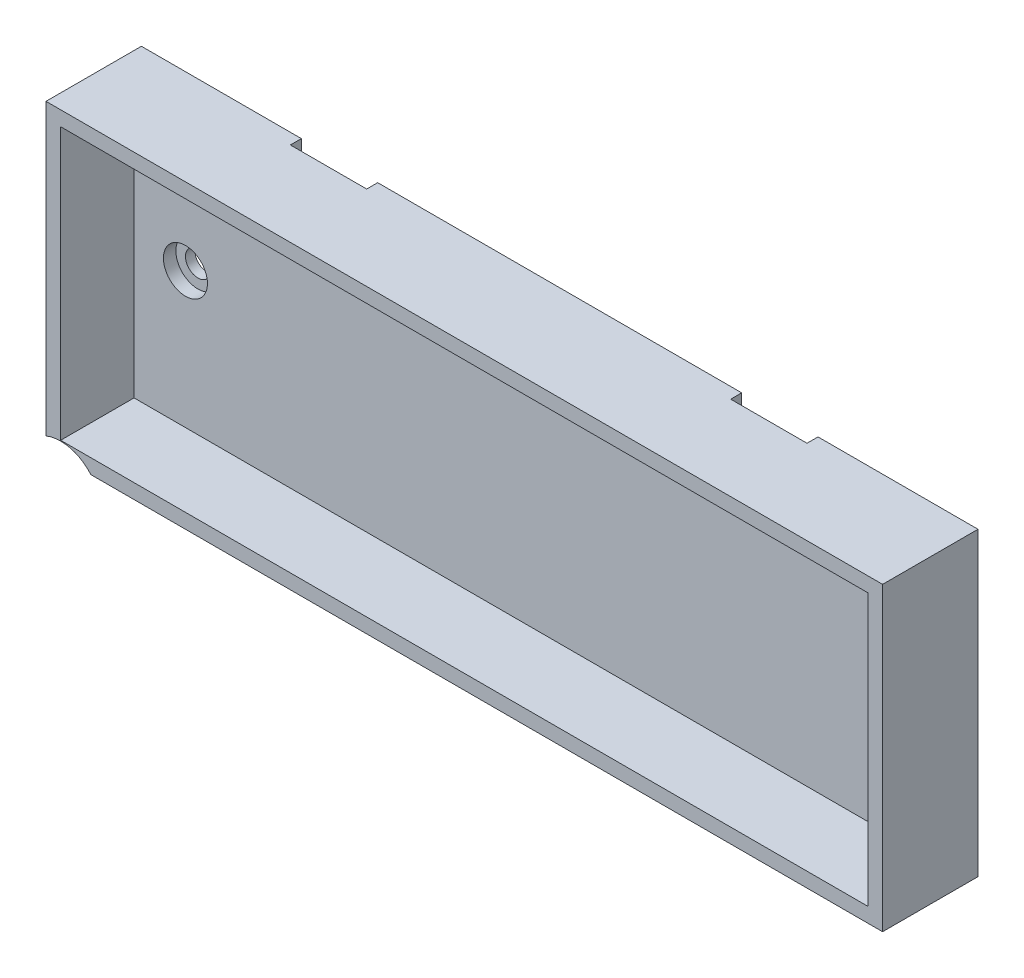
from build123d import *

# Parameters (mm, degrees)
MAIN_PROFILE_SKETCH_W       = 110
MAIN_PROFILE_SKETCH_H       = 37
MAIN_EXTRUSION_DEPTH        = 10
DETAIL_PROFILE_2_SKETCH_R   = 3
DETAIL_EXTRUSION_2_DEPTH    = 1.5
DETAIL_PROFILE_3_SKETCH_R   = 3
DETAIL_PROFILE_3_SKETCH_W   = 21.8
DETAIL_PROFILE_3_SKETCH_H   = 41
DETAIL_PROFILE_3_SKETCH_W_2 = 49.6
DETAIL_EXTRUSION_3_DEPTH    = 0.2
DETAIL_PROFILE_4_SKETCH_R   = 1.7
DETAIL_PROFILE_4_SKETCH_W   = 49.6
DETAIL_PROFILE_4_SKETCH_H   = 41
DETAIL_PROFILE_4_SKETCH_W_2 = 21.8
DETAIL_EXTRUSION_4_DEPTH    = 1.3


with BuildPart() as part:
    # Main Profile Sketch → Main Extrusion (new body)
    with BuildSketch(Plane.XY.offset(61.5)):
        with BuildLine():
            Line((-272, -6), (-158, -6))
            Line((-158, -6), (-158, -47))
            Line((-158, -47), (-265.887822961, -47))
            ThreePointArc((-265.887822961, -47), (-268.700050917, -45.258804298), (-272, -45.484025518))
            Line((-272, -45.484025518), (-272, -6))
        make_face()
        with Locations((-215, -26.5)):
            Rectangle(MAIN_PROFILE_SKETCH_W, MAIN_PROFILE_SKETCH_H, mode=Mode.SUBTRACT)
    extrude(amount=-MAIN_EXTRUSION_DEPTH)

    # Detail Profile 2 Sketch → Detail Extrusion 2 (add)
    with BuildSketch(Plane.XY.offset(51.5)):
        with BuildLine():
            Line((-272, -6), (-158, -6))
            Line((-158, -6), (-158, -47))
            Line((-158, -47), (-265.887822961, -47))
            ThreePointArc((-265.887822961, -47), (-268.700050917, -45.258804298), (-272, -45.484025518))
            Line((-272, -45.484025518), (-272, -6))
        make_face()
        with Locations((-263, -26.5)):
            Circle(DETAIL_PROFILE_2_SKETCH_R, mode=Mode.SUBTRACT)
        with Locations((-167, -26.5)):
            Circle(DETAIL_PROFILE_2_SKETCH_R, mode=Mode.SUBTRACT)
    extrude(amount=-DETAIL_EXTRUSION_2_DEPTH)

    # Detail Profile 3 Sketch → Detail Extrusion 3 (add)
    # profile 1 of 3: a face of its own
    with BuildSketch(Plane.XY.offset(50)):
        with BuildLine():
            Line((-272, -6), (-250.2, -6))
            Line((-250.2, -6), (-250.2, -47))
            Line((-250.2, -47), (-265.887822961, -47))
            ThreePointArc((-265.887822961, -47), (-268.700050917, -45.258804298), (-272, -45.484025518))
            Line((-272, -45.484025518), (-272, -6))
        make_face()
        with Locations((-263, -26.5)):
            Circle(DETAIL_PROFILE_3_SKETCH_R, mode=Mode.SUBTRACT)
    # profile 2 of 3: a face of its own
    with BuildSketch(Plane.XY.offset(50)):
        with Locations((-168.9, -26.5)):
            Rectangle(DETAIL_PROFILE_3_SKETCH_W, DETAIL_PROFILE_3_SKETCH_H)
        with Locations((-167, -26.5)):
            Circle(DETAIL_PROFILE_3_SKETCH_R, mode=Mode.SUBTRACT)
    # profile 3 of 3: a face of its own
    with BuildSketch(Plane.XY.offset(50)):
        with Locations((-215, -26.5)):
            Rectangle(DETAIL_PROFILE_3_SKETCH_W_2, DETAIL_PROFILE_3_SKETCH_H)
    extrude(amount=-DETAIL_EXTRUSION_3_DEPTH)

    # Detail Profile 4 Sketch → Detail Extrusion 4 (add)
    # profile 1 of 3: a face of its own
    with BuildSketch(Plane.XY.offset(49.8)):
        with BuildLine():
            Line((-272, -6), (-250.2, -6))
            Line((-250.2, -6), (-250.2, -47))
            Line((-250.2, -47), (-265.887822961, -47))
            ThreePointArc((-265.887822961, -47), (-268.700050917, -45.258804298), (-272, -45.484025518))
            Line((-272, -45.484025518), (-272, -6))
        make_face()
        with Locations((-263, -26.5)):
            Circle(DETAIL_PROFILE_4_SKETCH_R, mode=Mode.SUBTRACT)
    # profile 2 of 3: a face of its own
    with BuildSketch(Plane.XY.offset(49.8)):
        with Locations((-215, -26.5)):
            Rectangle(DETAIL_PROFILE_4_SKETCH_W, DETAIL_PROFILE_4_SKETCH_H)
    # profile 3 of 3: a face of its own
    with BuildSketch(Plane.XY.offset(49.8)):
        with Locations((-168.9, -26.5)):
            Rectangle(DETAIL_PROFILE_4_SKETCH_W_2, DETAIL_PROFILE_4_SKETCH_H)
        with Locations((-167, -26.5)):
            Circle(DETAIL_PROFILE_4_SKETCH_R, mode=Mode.SUBTRACT)
    extrude(amount=-DETAIL_EXTRUSION_4_DEPTH)


solid = part.part
